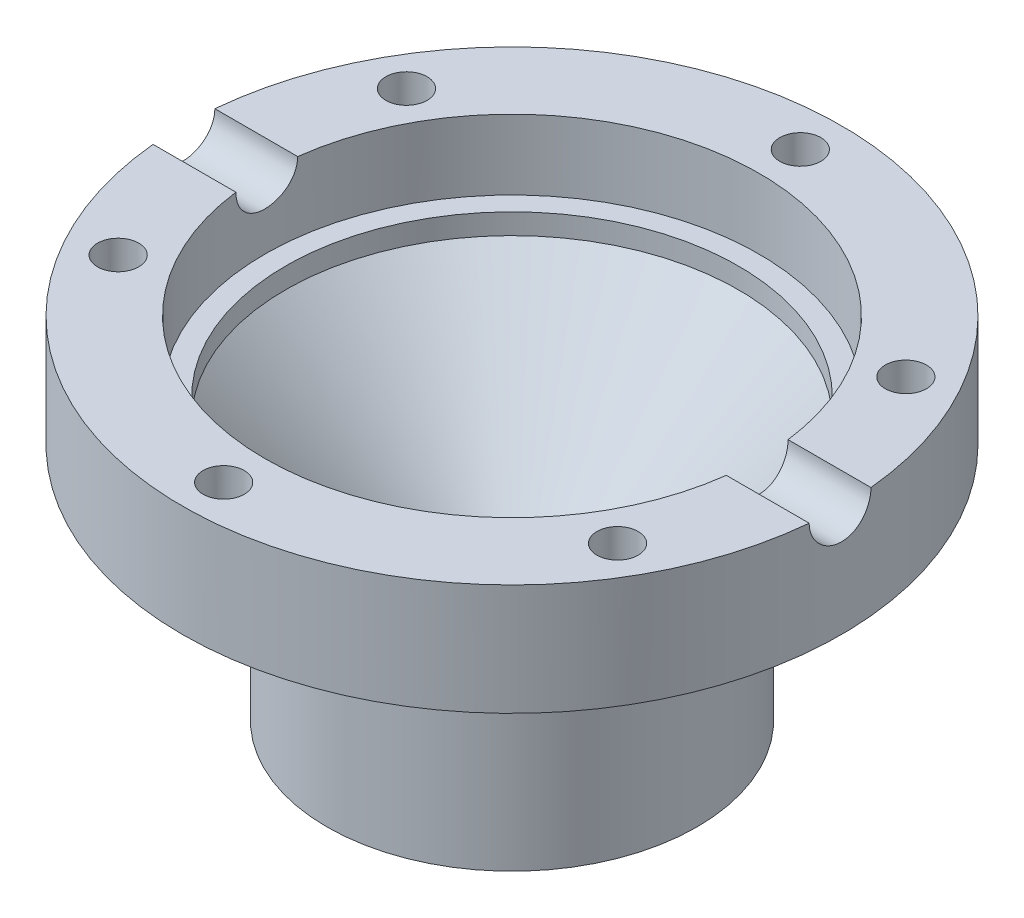
from build123d import *

# Parameters (mm, degrees)
SKETCH1_R           = 20.32
BOSS_EXTRUDE1_DEPTH = 21.59
SKETCH2_W           = 15.24
SKETCH2_H           = 4.318
SKETCH3_W           = 5.08
SKETCH3_H           = 14.732
CUT_EXTRUDE1_REACH  = 37.943
SKETCH4_R           = 1.27
CIRPATTERN1_COUNT   = 6
CUT_EXTRUDE2_REACH  = 37.943
SKETCH5_R           = 4.699
SKETCH9_R           = 1.905
CUT_EXTRUDE3_DEPTH  = 51.305467894


with BuildPart() as part:
    # Sketch1 → Boss-Extrude1 (new body)
    with BuildSketch(Plane(origin=(0, 0, 0), x_dir=(1, 0, 0), z_dir=(0, 1, 0))):
        with Locations(Location((0, 0, 0), (0, 0, 270))):
            Circle(SKETCH1_R)
    extrude(amount=BOSS_EXTRUDE1_DEPTH)

    # Sketch2 → Cut-Revolve1 (revolve, cut)
    with BuildSketch(Plane.XY, mode=Mode.PRIVATE) as cut_revolve1_sk:
        with Locations((-7.62, 19.431)):
            Rectangle(SKETCH2_W, SKETCH2_H)
    revolve(cut_revolve1_sk.sketch.rotate(Axis((0, 55, 0), (0, -1, 0)), 270), axis=Axis((0, 55, 0), (0, -1, 0)), mode=Mode.SUBTRACT)

    # Sketch3 → Cut-Revolve2 (revolve, cut)
    with BuildSketch(Plane.XY, mode=Mode.PRIVATE) as cut_revolve2_sk:
        with Locations((-17.78, 7.366)):
            Rectangle(SKETCH3_W, SKETCH3_H)
    revolve(cut_revolve2_sk.sketch.rotate(Axis((0, 55, 0), (0, -1, 0)), 270), axis=Axis((0, 55, 0), (0, -1, 0)), mode=Mode.SUBTRACT)

    # Sketch4 → Cut-Extrude1 (cut, up to next)
    with BuildSketch(Plane(origin=(0, 21.59, 0), x_dir=(1, 0, 0), z_dir=(0, 1, 0)), mode=Mode.PRIVATE) as cut_extrude1_sk1:
        with Locations(Location((0, 17.78, 0), (0, 0, 270))):
            Circle(SKETCH4_R)
    cut_extrude1_tool1 = extrude(cut_extrude1_sk1.sketch, amount=-CUT_EXTRUDE1_REACH, mode=Mode.PRIVATE) & part.part
    cut_extrude1 = cut_extrude1_tool1.solids().sort_by_distance((0, 21.59, -17.78))[0]
    add(cut_extrude1, mode=Mode.SUBTRACT)

    # CirPattern1: Cut-Extrude1 ×6 about axis
    cirpattern1_axis = Axis((0, 0, 0), (0, 1, 0))
    for i in range(1, CIRPATTERN1_COUNT):
        add(cut_extrude1.rotate(cirpattern1_axis, i * 360 / CIRPATTERN1_COUNT), mode=Mode.SUBTRACT)

    # Sketch5 → Cut-Extrude2 (cut, up to next)
    with BuildSketch(Plane.XZ, mode=Mode.PRIVATE) as cut_extrude2_sk1:
        with Locations(Location((0, 0, 0), (0, 0, 270))):
            Circle(SKETCH5_R)
    cut_extrude2_tool1 = extrude(cut_extrude2_sk1.sketch, amount=-CUT_EXTRUDE2_REACH, mode=Mode.PRIVATE) & part.part
    add(cut_extrude2_tool1.solids().sort_by_distance((0, 0, 0))[0], mode=Mode.SUBTRACT)

    # Sketch7 → Cut-Revolve3 (revolve, cut)
    with BuildSketch(Plane.XY, mode=Mode.PRIVATE) as cut_revolve3_sk:
        Polygon((-15.24, 14.732), (-11.40968, 10.90168), (-11.40968, 0), (-15.24, 0), align=None)
    revolve(cut_revolve3_sk.sketch.rotate(Axis((0, 55, 0), (0, -1, 0)), 270), axis=Axis((0, 55, 0), (0, -1, 0)), mode=Mode.SUBTRACT)

    # Sketch8 → Cut-Revolve4 (revolve, cut)
    with BuildSketch(Plane.XY, mode=Mode.PRIVATE) as cut_revolve4_sk:
        Polygon((-4.699, 17.272), (-13.97, 17.272), (-13.97, 16.002), (-4.699, 6.731), align=None)
    revolve(cut_revolve4_sk.sketch.rotate(Axis((0, 55, 0), (0, -1, 0)), 270), axis=Axis((0, 55, 0), (0, -1, 0)), mode=Mode.SUBTRACT)

    # Sketch9 → Cut-Extrude3 (cut, through all)
    with BuildSketch(Plane(origin=(20.32, 0, 0), x_dir=(0, 0, -1), z_dir=(1, 0, 0))):
        with Locations((0, 21.59)):
            Circle(SKETCH9_R)
    extrude(amount=-CUT_EXTRUDE3_DEPTH, mode=Mode.SUBTRACT)


solid = part.part
